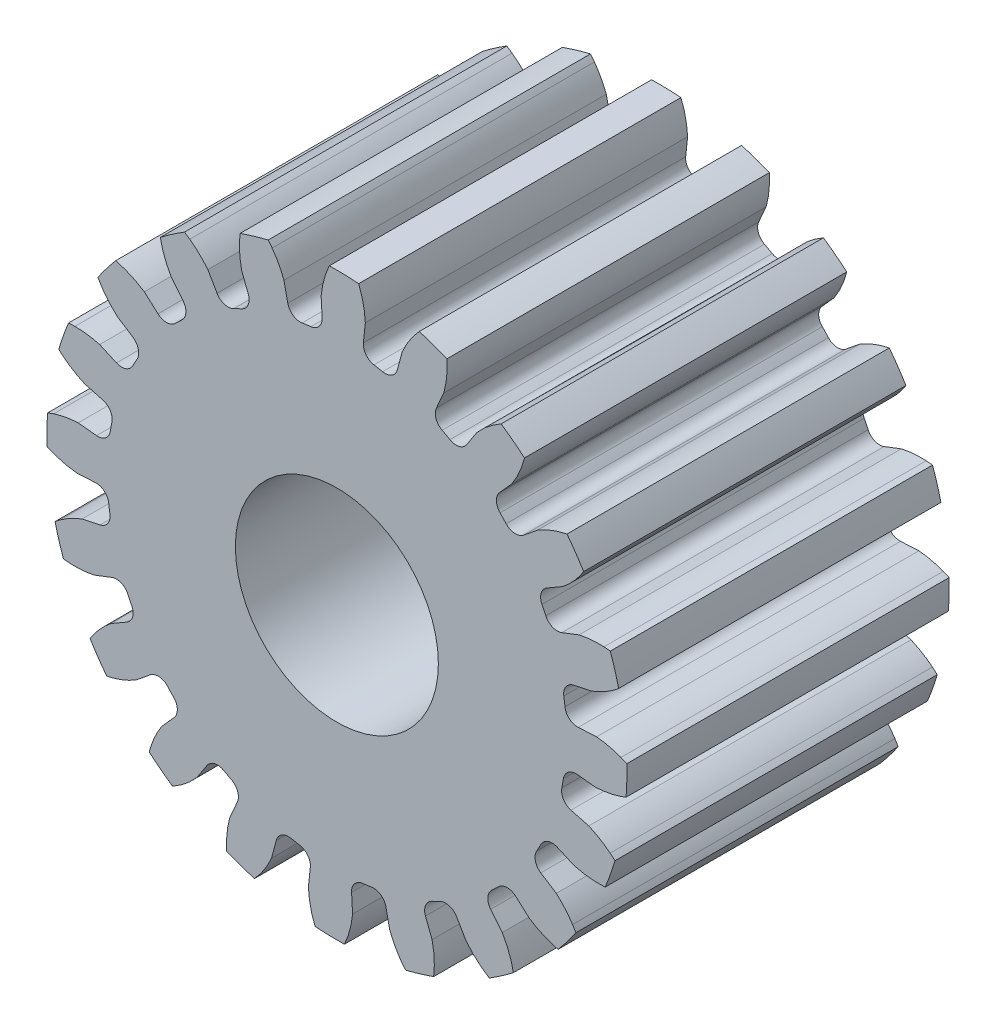
from build123d import *

# Parameters (mm, degrees)
SKETCH1_R           = 2
BOSS_EXTRUDE1_DEPTH = 6.35


with BuildPart() as part:
    # Sketch1 → Boss-Extrude1 (new body)
    with BuildSketch(Plane.XY):
        with BuildLine():
            Line((541.91920356, -238.032833552), (542.200542121, -237.804244593))
            ThreePointArc((542.200542121, -237.804244593), (542.376229885, -237.749043127), (542.54194547, -237.829365837))
            ThreePointArc((542.54194547, -237.829365837), (542.601476905, -237.893112552), (542.662226396, -237.955699571))
            ThreePointArc((542.662226396, -237.955699571), (542.734322782, -238.125156066), (542.670568959, -238.297924241))
            Line((542.670568959, -238.297924241), (542.428453434, -238.567710027))
            add(Edge.make_bspline(
                [(542.428453434, -238.567710027), (542.290505976, -238.776468723), (542.214843318, -239.011053945)],
                knots=[0, 0, 0, 1, 1, 1], degree=2))
            add(Edge.make_bspline(
                [(542.214843318, -239.011053945), (542.195602677, -239.07070781), (542.180389743, -239.132031774)],
                knots=[0, 0, 0, 1, 1, 1], degree=2))
            ThreePointArc((542.180389743, -239.132031774), (542.40591146, -239.313731208), (542.640348386, -239.483772548))
            add(Edge.make_bspline(
                [(542.640348386, -239.483772548), (542.695544755, -239.453024822), (542.748074148, -239.418827618)],
                knots=[0, 0, 0, 1, 1, 1], degree=2))
            add(Edge.make_bspline(
                [(542.748074148, -239.418827618), (542.954642815, -239.284349182), (543.119969158, -239.096527738)],
                knots=[0, 0, 0, 1, 1, 1], degree=2))
            Line((543.119969158, -239.096527738), (543.316900156, -238.792188323))
            ThreePointArc((543.316900156, -238.792188323), (543.466930958, -238.685398104), (543.649356927, -238.710580609))
            ThreePointArc((543.649356927, -238.710580609), (543.725673505, -238.752811113), (543.802790156, -238.793562279))
            ThreePointArc((543.802790156, -238.793562279), (543.923722831, -238.932445974), (543.916477644, -239.116459288))
            Line((543.916477644, -239.116459288), (543.769580489, -239.44785863))
            add(Edge.make_bspline(
                [(543.769580489, -239.44785863), (543.702894645, -239.689028057), (543.703426001, -239.935512908)],
                knots=[0, 0, 0, 1, 1, 1], degree=2))
            add(Edge.make_bspline(
                [(543.703426001, -239.935512908), (543.703561122, -239.99819279), (543.70804291, -240.0612164)],
                knots=[0, 0, 0, 1, 1, 1], degree=2))
            ThreePointArc((543.70804291, -240.0612164), (543.978675021, -240.164332788), (544.254183451, -240.253606718))
            add(Edge.make_bspline(
                [(544.254183451, -240.253606718), (544.297176747, -240.207307277), (544.336567653, -240.158551329)],
                knots=[0, 0, 0, 1, 1, 1], degree=2))
            add(Edge.make_bspline(
                [(544.336567653, -240.158551329), (544.491470007, -239.966821506), (544.590664684, -239.737104049)],
                knots=[0, 0, 0, 1, 1, 1], degree=2))
            Line((544.590664684, -239.737104049), (544.683911142, -239.38680504))
            ThreePointArc((544.683911142, -239.38680504), (544.793598922, -239.238879439), (544.97487815, -239.206456699))
            ThreePointArc((544.97487815, -239.206456699), (545.060509472, -239.223037176), (545.146444569, -239.237963482))
            ThreePointArc((545.146444569, -239.237963482), (545.304375799, -239.332679474), (545.354348458, -239.509925422))
            Line((545.354348458, -239.509925422), (545.31704899, -239.870498642))
            add(Edge.make_bspline(
                [(545.31704899, -239.870498642), (545.328152435, -240.120471456), (545.404825793, -240.354728282)],
                knots=[0, 0, 0, 1, 1, 1], degree=2))
            add(Edge.make_bspline(
                [(545.404825793, -240.354728282), (545.424323449, -240.414298638), (545.448061249, -240.472852704)],
                knots=[0, 0, 0, 1, 1, 1], degree=2))
            ThreePointArc((545.448061249, -240.472852704), (545.737312398, -240.487292295), (546.026923647, -240.487060061))
            add(Edge.make_bspline(
                [(546.026923647, -240.487060061), (546.053505388, -240.429741017), (546.075901948, -240.371198895)],
                knots=[0, 0, 0, 1, 1, 1], degree=2))
            add(Edge.make_bspline(
                [(546.075901948, -240.371198895), (546.163975068, -240.140985538), (546.187328214, -239.891858412)],
                knots=[0, 0, 0, 1, 1, 1], degree=2))
            Line((546.187328214, -239.891858412), (546.167762518, -239.529889517))
            ThreePointArc((546.167762518, -239.529889517), (546.226370272, -239.355308522), (546.388757885, -239.268454303))
            ThreePointArc((546.388757885, -239.268454303), (546.475321761, -239.257761739), (546.561663378, -239.245402095))
            ThreePointArc((546.561663378, -239.245402095), (546.741133754, -239.286678922), (546.843432588, -239.439807434))
            Line((546.843432588, -239.439807434), (546.919381938, -239.794259114))
            add(Edge.make_bspline(
                [(546.919381938, -239.794259114), (547.007187789, -240.028566235), (547.152497826, -240.227664345)],
                knots=[0, 0, 0, 1, 1, 1], degree=2))
            add(Edge.make_bspline(
                [(547.152497826, -240.227664345), (547.189449452, -240.278294013), (547.230119642, -240.326646856)],
                knots=[0, 0, 0, 1, 1, 1], degree=2))
            ThreePointArc((547.230119642, -240.326646856), (547.509675912, -240.250996202), (547.785040813, -240.161280537))
            add(Edge.make_bspline(
                [(547.785040813, -240.161280537), (547.792608992, -240.098552677), (547.795818876, -240.035954893)],
                knots=[0, 0, 0, 1, 1, 1], degree=2))
            add(Edge.make_bspline(
                [(547.795818876, -240.035954893), (547.808441551, -239.789792889), (547.753667197, -239.545642393)],
                knots=[0, 0, 0, 1, 1, 1], degree=2))
            Line((547.753667197, -239.545642393), (547.623204575, -239.207435649))
            ThreePointArc((547.623204575, -239.207435649), (547.624995366, -239.023288465), (547.752595734, -238.890504661))
            ThreePointArc((547.752595734, -238.890504661), (547.831618689, -238.85358572), (547.909915105, -238.815149973))
            ThreePointArc((547.909915105, -238.815149973), (548.093356817, -238.798947172), (548.237968102, -238.912968963))
            Line((548.237968102, -238.912968963), (548.41973182, -239.226602904))
            add(Edge.make_bspline(
                [(548.41973182, -239.226602904), (548.575645029, -239.422308717), (548.775367786, -239.566759001)],
                knots=[0, 0, 0, 1, 1, 1], degree=2))
            add(Edge.make_bspline(
                [(548.775367786, -239.566759001), (548.826156298, -239.603491997), (548.879777798, -239.636910503)],
                knots=[0, 0, 0, 1, 1, 1], degree=2))
            ThreePointArc((548.879777798, -239.636910503), (549.122274272, -239.478574817), (549.35643819, -239.308157716))
            add(Edge.make_bspline(
                [(549.35643819, -239.308157716), (549.344251982, -239.246161279), (549.327960984, -239.18563534)],
                knots=[0, 0, 0, 1, 1, 1], degree=2))
            add(Edge.make_bspline(
                [(549.327960984, -239.18563534), (549.263897619, -238.947620741), (549.13635746, -238.732346028)],
                knots=[0, 0, 0, 1, 1, 1], degree=2))
            Line((549.13635746, -238.732346028), (548.907768501, -238.451007467))
            ThreePointArc((548.907768501, -238.451007467), (548.852567036, -238.275319702), (548.932889745, -238.109604118))
            ThreePointArc((548.932889745, -238.109604118), (548.996636461, -238.050072683), (549.059223479, -237.989323192))
            ThreePointArc((549.059223479, -237.989323192), (549.228679974, -237.917226806), (549.40144815, -237.980980629))
            Line((549.40144815, -237.980980629), (549.671233935, -238.223096154))
            add(Edge.make_bspline(
                [(549.671233935, -238.223096154), (549.879992631, -238.361043612), (550.114577853, -238.43670627)],
                knots=[0, 0, 0, 1, 1, 1], degree=2))
            add(Edge.make_bspline(
                [(550.114577853, -238.43670627), (550.174231719, -238.455946911), (550.235555682, -238.471159844)],
                knots=[0, 0, 0, 1, 1, 1], degree=2))
            ThreePointArc((550.235555682, -238.471159844), (550.417255116, -238.245638128), (550.587296456, -238.011201202))
            add(Edge.make_bspline(
                [(550.587296456, -238.011201202), (550.55654873, -237.956004833), (550.522351527, -237.903475439)],
                knots=[0, 0, 0, 1, 1, 1], degree=2))
            add(Edge.make_bspline(
                [(550.522351527, -237.903475439), (550.38787309, -237.696906773), (550.200051646, -237.53158043)],
                knots=[0, 0, 0, 1, 1, 1], degree=2))
            Line((550.200051646, -237.53158043), (549.895712231, -237.334649432))
            ThreePointArc((549.895712231, -237.334649432), (549.788922012, -237.184618629), (549.814104517, -237.002192661))
            ThreePointArc((549.814104517, -237.002192661), (549.856335021, -236.925876083), (549.897086187, -236.848759432))
            ThreePointArc((549.897086187, -236.848759432), (550.035969882, -236.727826757), (550.219983197, -236.735071944))
            Line((550.219983197, -236.735071944), (550.551382538, -236.881969099))
            add(Edge.make_bspline(
                [(550.551382538, -236.881969099), (550.792551965, -236.948654943), (551.039036816, -236.948123587)],
                knots=[0, 0, 0, 1, 1, 1], degree=2))
            add(Edge.make_bspline(
                [(551.039036816, -236.948123587), (551.101716698, -236.947988466), (551.164740308, -236.943506678)],
                knots=[0, 0, 0, 1, 1, 1], degree=2))
            ThreePointArc((551.164740308, -236.943506678), (551.267856696, -236.672874567), (551.357130626, -236.397366137))
            add(Edge.make_bspline(
                [(551.357130626, -236.397366137), (551.310831185, -236.354372841), (551.262075237, -236.314981935)],
                knots=[0, 0, 0, 1, 1, 1], degree=2))
            add(Edge.make_bspline(
                [(551.262075237, -236.314981935), (551.070345415, -236.160079581), (550.840627957, -236.060884904)],
                knots=[0, 0, 0, 1, 1, 1], degree=2))
            Line((550.840627957, -236.060884904), (550.490328948, -235.967638446))
            ThreePointArc((550.490328948, -235.967638446), (550.342403347, -235.857950666), (550.309980608, -235.676671438))
            ThreePointArc((550.309980608, -235.676671438), (550.326561084, -235.591040116), (550.341487391, -235.505105019))
            ThreePointArc((550.341487391, -235.505105019), (550.436203382, -235.347173789), (550.61344933, -235.29720113))
            Line((550.61344933, -235.29720113), (550.97402255, -235.334500598))
            add(Edge.make_bspline(
                [(550.97402255, -235.334500598), (551.223995364, -235.323397153), (551.45825219, -235.246723795)],
                knots=[0, 0, 0, 1, 1, 1], degree=2))
            add(Edge.make_bspline(
                [(551.45825219, -235.246723795), (551.517822546, -235.227226139), (551.576376612, -235.203488339)],
                knots=[0, 0, 0, 1, 1, 1], degree=2))
            ThreePointArc((551.576376612, -235.203488339), (551.590816203, -234.91423719), (551.590583969, -234.624625941))
            add(Edge.make_bspline(
                [(551.590583969, -234.624625941), (551.533264925, -234.5980442), (551.474722803, -234.57564764)],
                knots=[0, 0, 0, 1, 1, 1], degree=2))
            add(Edge.make_bspline(
                [(551.474722803, -234.57564764), (551.244509447, -234.48757452), (550.995382321, -234.464221374)],
                knots=[0, 0, 0, 1, 1, 1], degree=2))
            Line((550.995382321, -234.464221374), (550.633413425, -234.48378707))
            ThreePointArc((550.633413425, -234.48378707), (550.458832431, -234.425179316), (550.371978211, -234.262791703))
            ThreePointArc((550.371978211, -234.262791703), (550.361285647, -234.176227827), (550.348926003, -234.08988621))
            ThreePointArc((550.348926003, -234.08988621), (550.39020283, -233.910415834), (550.543331342, -233.808117))
            Line((550.543331342, -233.808117), (550.897783023, -233.73216765))
            add(Edge.make_bspline(
                [(550.897783023, -233.73216765), (551.132090143, -233.644361799), (551.331188253, -233.499051762)],
                knots=[0, 0, 0, 1, 1, 1], degree=2))
            add(Edge.make_bspline(
                [(551.331188253, -233.499051762), (551.381817921, -233.462100136), (551.430170764, -233.421429946)],
                knots=[0, 0, 0, 1, 1, 1], degree=2))
            ThreePointArc((551.430170764, -233.421429946), (551.35452011, -233.141873676), (551.264804445, -232.866508775))
            add(Edge.make_bspline(
                [(551.264804445, -232.866508775), (551.202076585, -232.858940596), (551.139478801, -232.855730712)],
                knots=[0, 0, 0, 1, 1, 1], degree=2))
            add(Edge.make_bspline(
                [(551.139478801, -232.855730712), (550.893316797, -232.843108037), (550.649166301, -232.897882391)],
                knots=[0, 0, 0, 1, 1, 1], degree=2))
            Line((550.649166301, -232.897882391), (550.310959557, -233.028345013))
            ThreePointArc((550.310959557, -233.028345013), (550.126812373, -233.026554222), (549.994028569, -232.898953854))
            ThreePointArc((549.994028569, -232.898953854), (549.957109628, -232.819930899), (549.918673881, -232.741634483))
            ThreePointArc((549.918673881, -232.741634483), (549.90247108, -232.558192771), (550.016492871, -232.413581486))
            Line((550.016492871, -232.413581486), (550.330126812, -232.231817768))
            add(Edge.make_bspline(
                [(550.330126812, -232.231817768), (550.525832625, -232.075904559), (550.67028291, -231.876181802)],
                knots=[0, 0, 0, 1, 1, 1], degree=2))
            add(Edge.make_bspline(
                [(550.67028291, -231.876181802), (550.707015905, -231.82539329), (550.740434411, -231.77177179)],
                knots=[0, 0, 0, 1, 1, 1], degree=2))
            ThreePointArc((550.740434411, -231.77177179), (550.582098726, -231.529275316), (550.411681624, -231.295111398))
            add(Edge.make_bspline(
                [(550.411681624, -231.295111398), (550.349685188, -231.307297606), (550.289159248, -231.323588604)],
                knots=[0, 0, 0, 1, 1, 1], degree=2))
            add(Edge.make_bspline(
                [(550.289159248, -231.323588604), (550.051144649, -231.387651969), (549.835869936, -231.515192128)],
                knots=[0, 0, 0, 1, 1, 1], degree=2))
            Line((549.835869936, -231.515192128), (549.554531376, -231.743781087))
            ThreePointArc((549.554531376, -231.743781087), (549.378843611, -231.798982552), (549.213128026, -231.718659843))
            ThreePointArc((549.213128026, -231.718659843), (549.153596591, -231.654913127), (549.0928471, -231.592326109))
            ThreePointArc((549.0928471, -231.592326109), (549.020750714, -231.422869614), (549.084504537, -231.250101438))
            Line((549.084504537, -231.250101438), (549.326620062, -230.980315653))
            add(Edge.make_bspline(
                [(549.326620062, -230.980315653), (549.46456752, -230.771556957), (549.540230178, -230.536971735)],
                knots=[0, 0, 0, 1, 1, 1], degree=2))
            add(Edge.make_bspline(
                [(549.540230178, -230.536971735), (549.559470819, -230.477317869), (549.574683753, -230.415993906)],
                knots=[0, 0, 0, 1, 1, 1], degree=2))
            ThreePointArc((549.574683753, -230.415993906), (549.349162036, -230.234294472), (549.114725111, -230.064253132))
            add(Edge.make_bspline(
                [(549.114725111, -230.064253132), (549.059528741, -230.095000858), (549.006999348, -230.129198061)],
                knots=[0, 0, 0, 1, 1, 1], degree=2))
            add(Edge.make_bspline(
                [(549.006999348, -230.129198061), (548.800430681, -230.263676498), (548.635104338, -230.451497942)],
                knots=[0, 0, 0, 1, 1, 1], degree=2))
            Line((548.635104338, -230.451497942), (548.43817334, -230.755837357))
            ThreePointArc((548.43817334, -230.755837357), (548.288142538, -230.862627576), (548.105716569, -230.837445071))
            ThreePointArc((548.105716569, -230.837445071), (548.029399991, -230.795214567), (547.95228334, -230.754463401))
            ThreePointArc((547.95228334, -230.754463401), (547.831350666, -230.615579705), (547.838595852, -230.431566391))
            Line((547.838595852, -230.431566391), (547.985493007, -230.10016705))
            add(Edge.make_bspline(
                [(547.985493007, -230.10016705), (548.052178851, -229.858997623), (548.051647495, -229.612512772)],
                knots=[0, 0, 0, 1, 1, 1], degree=2))
            add(Edge.make_bspline(
                [(548.051647495, -229.612512772), (548.051512374, -229.549832889), (548.047030586, -229.48680928)],
                knots=[0, 0, 0, 1, 1, 1], degree=2))
            ThreePointArc((548.047030586, -229.48680928), (547.776398475, -229.383692892), (547.500890046, -229.294418962))
            add(Edge.make_bspline(
                [(547.500890046, -229.294418962), (547.457896749, -229.340718402), (547.418505844, -229.389474351)],
                knots=[0, 0, 0, 1, 1, 1], degree=2))
            add(Edge.make_bspline(
                [(547.418505844, -229.389474351), (547.263603489, -229.581204173), (547.164408812, -229.810921631)],
                knots=[0, 0, 0, 1, 1, 1], degree=2))
            Line((547.164408812, -229.810921631), (547.071162354, -230.16122064))
            ThreePointArc((547.071162354, -230.16122064), (546.961474574, -230.309146241), (546.780195346, -230.34156898))
            ThreePointArc((546.780195346, -230.34156898), (546.694564024, -230.324988504), (546.608628927, -230.310062197))
            ThreePointArc((546.608628927, -230.310062197), (546.450697697, -230.215346205), (546.400725038, -230.038100258))
            Line((546.400725038, -230.038100258), (546.438024506, -229.677527038))
            add(Edge.make_bspline(
                [(546.438024506, -229.677527038), (546.426921061, -229.427554224), (546.350247704, -229.193297398)],
                knots=[0, 0, 0, 1, 1, 1], degree=2))
            add(Edge.make_bspline(
                [(546.350247704, -229.193297398), (546.330750047, -229.133727042), (546.307012247, -229.075172976)],
                knots=[0, 0, 0, 1, 1, 1], degree=2))
            ThreePointArc((546.307012247, -229.075172976), (546.017761098, -229.060733385), (545.728149849, -229.060965618))
            add(Edge.make_bspline(
                [(545.728149849, -229.060965618), (545.701568108, -229.118284663), (545.679171548, -229.176826785)],
                knots=[0, 0, 0, 1, 1, 1], degree=2))
            add(Edge.make_bspline(
                [(545.679171548, -229.176826785), (545.591098428, -229.407040141), (545.567745282, -229.656167267)],
                knots=[0, 0, 0, 1, 1, 1], degree=2))
            Line((545.567745282, -229.656167267), (545.587310978, -230.018136163))
            ThreePointArc((545.587310978, -230.018136163), (545.528703224, -230.192717157), (545.366315611, -230.279571377))
            ThreePointArc((545.366315611, -230.279571377), (545.279751735, -230.290263941), (545.193410119, -230.302623585))
            ThreePointArc((545.193410119, -230.302623585), (545.013939742, -230.261346758), (544.911640909, -230.108218246))
            Line((544.911640909, -230.108218246), (544.835691558, -229.753766565))
            add(Edge.make_bspline(
                [(544.835691558, -229.753766565), (544.747885707, -229.519459445), (544.60257567, -229.320361335)],
                knots=[0, 0, 0, 1, 1, 1], degree=2))
            add(Edge.make_bspline(
                [(544.60257567, -229.320361335), (544.565624044, -229.269731667), (544.524953854, -229.221378824)],
                knots=[0, 0, 0, 1, 1, 1], degree=2))
            ThreePointArc((544.524953854, -229.221378824), (544.245397584, -229.297029478), (543.970032683, -229.386745142))
            add(Edge.make_bspline(
                [(543.970032683, -229.386745142), (543.962464504, -229.449473003), (543.95925462, -229.512070787)],
                knots=[0, 0, 0, 1, 1, 1], degree=2))
            add(Edge.make_bspline(
                [(543.95925462, -229.512070787), (543.946631945, -229.758232791), (544.001406299, -230.002383286)],
                knots=[0, 0, 0, 1, 1, 1], degree=2))
            Line((544.001406299, -230.002383286), (544.131868922, -230.34059003))
            ThreePointArc((544.131868922, -230.34059003), (544.13007813, -230.524737215), (544.002477762, -230.657521019))
            ThreePointArc((544.002477762, -230.657521019), (543.923454808, -230.69443996), (543.845158391, -230.732875707))
            ThreePointArc((543.845158391, -230.732875707), (543.661716679, -230.749078508), (543.517105394, -230.635056717))
            Line((543.517105394, -230.635056717), (543.335341677, -230.321422776))
            add(Edge.make_bspline(
                [(543.335341677, -230.321422776), (543.179428467, -230.125716963), (542.979705711, -229.981266678)],
                knots=[0, 0, 0, 1, 1, 1], degree=2))
            add(Edge.make_bspline(
                [(542.979705711, -229.981266678), (542.928917198, -229.944533683), (542.875295698, -229.911115177)],
                knots=[0, 0, 0, 1, 1, 1], degree=2))
            ThreePointArc((542.875295698, -229.911115177), (542.632799224, -230.069450862), (542.398635306, -230.239867964))
            add(Edge.make_bspline(
                [(542.398635306, -230.239867964), (542.410821514, -230.3018644), (542.427112512, -230.36239034)],
                knots=[0, 0, 0, 1, 1, 1], degree=2))
            add(Edge.make_bspline(
                [(542.427112512, -230.36239034), (542.491175878, -230.600404939), (542.618716036, -230.815679652)],
                knots=[0, 0, 0, 1, 1, 1], degree=2))
            Line((542.618716036, -230.815679652), (542.847304995, -231.097018212))
            ThreePointArc((542.847304995, -231.097018212), (542.902506461, -231.272705977), (542.822183751, -231.438421561))
            ThreePointArc((542.822183751, -231.438421561), (542.758437035, -231.497952997), (542.695850017, -231.558702488))
            ThreePointArc((542.695850017, -231.558702488), (542.526393522, -231.630798873), (542.353625346, -231.567045051))
            Line((542.353625346, -231.567045051), (542.083839561, -231.324929526))
            add(Edge.make_bspline(
                [(542.083839561, -231.324929526), (541.875080865, -231.186982068), (541.640495643, -231.111319409)],
                knots=[0, 0, 0, 1, 1, 1], degree=2))
            add(Edge.make_bspline(
                [(541.640495643, -231.111319409), (541.580841778, -231.092078768), (541.519517814, -231.076865835)],
                knots=[0, 0, 0, 1, 1, 1], degree=2))
            ThreePointArc((541.519517814, -231.076865835), (541.33781838, -231.302387552), (541.16777704, -231.536824477))
            add(Edge.make_bspline(
                [(541.16777704, -231.536824477), (541.198524766, -231.592020847), (541.232721969, -231.64455024)],
                knots=[0, 0, 0, 1, 1, 1], degree=2))
            add(Edge.make_bspline(
                [(541.232721969, -231.64455024), (541.367200406, -231.851118907), (541.55502185, -232.01644525)],
                knots=[0, 0, 0, 1, 1, 1], degree=2))
            Line((541.55502185, -232.01644525), (541.859361265, -232.213376248))
            ThreePointArc((541.859361265, -232.213376248), (541.966151484, -232.36340705), (541.940968979, -232.545833019))
            ThreePointArc((541.940968979, -232.545833019), (541.898738475, -232.622149597), (541.857987309, -232.699266248))
            ThreePointArc((541.857987309, -232.699266248), (541.719103614, -232.820198922), (541.535090299, -232.812953736))
            Line((541.535090299, -232.812953736), (541.203690958, -232.666056581))
            add(Edge.make_bspline(
                [(541.203690958, -232.666056581), (540.962521531, -232.599370737), (540.71603668, -232.599902093)],
                knots=[0, 0, 0, 1, 1, 1], degree=2))
            add(Edge.make_bspline(
                [(540.71603668, -232.599902093), (540.653356798, -232.600037214), (540.590333188, -232.604519002)],
                knots=[0, 0, 0, 1, 1, 1], degree=2))
            ThreePointArc((540.590333188, -232.604519002), (540.4872168, -232.875151113), (540.39794287, -233.150659542))
            add(Edge.make_bspline(
                [(540.39794287, -233.150659542), (540.444242311, -233.193652839), (540.492998259, -233.233043744)],
                knots=[0, 0, 0, 1, 1, 1], degree=2))
            add(Edge.make_bspline(
                [(540.492998259, -233.233043744), (540.684728082, -233.387946099), (540.914445539, -233.487140776)],
                knots=[0, 0, 0, 1, 1, 1], degree=2))
            Line((540.914445539, -233.487140776), (541.264744548, -233.580387233))
            ThreePointArc((541.264744548, -233.580387233), (541.412670149, -233.690075014), (541.445092888, -233.871354242))
            ThreePointArc((541.445092888, -233.871354242), (541.428512412, -233.956985564), (541.413586106, -234.042920661))
            ThreePointArc((541.413586106, -234.042920661), (541.318870114, -234.200851891), (541.141624166, -234.25082455))
            Line((541.141624166, -234.25082455), (540.781050946, -234.213525082))
            add(Edge.make_bspline(
                [(540.781050946, -234.213525082), (540.531078132, -234.224628527), (540.296821306, -234.301301884)],
                knots=[0, 0, 0, 1, 1, 1], degree=2))
            add(Edge.make_bspline(
                [(540.296821306, -234.301301884), (540.23725095, -234.320799541), (540.178696884, -234.344537341)],
                knots=[0, 0, 0, 1, 1, 1], degree=2))
            ThreePointArc((540.178696884, -234.344537341), (540.164257293, -234.63378849), (540.164489527, -234.923399739))
            add(Edge.make_bspline(
                [(540.164489527, -234.923399739), (540.221808571, -234.94998148), (540.280350693, -234.97237804)],
                knots=[0, 0, 0, 1, 1, 1], degree=2))
            add(Edge.make_bspline(
                [(540.280350693, -234.97237804), (540.51056405, -235.06045116), (540.759691176, -235.083804306)],
                knots=[0, 0, 0, 1, 1, 1], degree=2))
            Line((540.759691176, -235.083804306), (541.121660071, -235.06423861))
            ThreePointArc((541.121660071, -235.06423861), (541.296241066, -235.122846364), (541.383095285, -235.285233977))
            ThreePointArc((541.383095285, -235.285233977), (541.393787849, -235.371797853), (541.406147493, -235.458139469))
            ThreePointArc((541.406147493, -235.458139469), (541.364870666, -235.637609846), (541.211742154, -235.739908679))
            Line((541.211742154, -235.739908679), (540.857290473, -235.81585803))
            add(Edge.make_bspline(
                [(540.857290473, -235.81585803), (540.622983353, -235.903663881), (540.423885243, -236.048973918)],
                knots=[0, 0, 0, 1, 1, 1], degree=2))
            add(Edge.make_bspline(
                [(540.423885243, -236.048973918), (540.373255575, -236.085925544), (540.324902732, -236.126595734)],
                knots=[0, 0, 0, 1, 1, 1], degree=2))
            ThreePointArc((540.324902732, -236.126595734), (540.400553386, -236.406152004), (540.490269051, -236.681516905))
            add(Edge.make_bspline(
                [(540.490269051, -236.681516905), (540.552996911, -236.689085084), (540.615594695, -236.692294968)],
                knots=[0, 0, 0, 1, 1, 1], degree=2))
            add(Edge.make_bspline(
                [(540.615594695, -236.692294968), (540.861756699, -236.704917643), (541.105907195, -236.650143289)],
                knots=[0, 0, 0, 1, 1, 1], degree=2))
            Line((541.105907195, -236.650143289), (541.444113939, -236.519680666))
            ThreePointArc((541.444113939, -236.519680666), (541.628261123, -236.521471458), (541.761044927, -236.649071826))
            ThreePointArc((541.761044927, -236.649071826), (541.797963868, -236.72809478), (541.836399615, -236.806391197))
            ThreePointArc((541.836399615, -236.806391197), (541.852602416, -236.989832909), (541.738580625, -237.134444194))
            Line((541.738580625, -237.134444194), (541.424946684, -237.316207911))
            add(Edge.make_bspline(
                [(541.424946684, -237.316207911), (541.229240871, -237.472121121), (541.084790587, -237.671843877)],
                knots=[0, 0, 0, 1, 1, 1], degree=2))
            add(Edge.make_bspline(
                [(541.084790587, -237.671843877), (541.048057591, -237.72263239), (541.014639085, -237.77625389)],
                knots=[0, 0, 0, 1, 1, 1], degree=2))
            ThreePointArc((541.014639085, -237.77625389), (541.172974771, -238.018750364), (541.343391872, -238.252914282))
            add(Edge.make_bspline(
                [(541.343391872, -238.252914282), (541.405388309, -238.240728073), (541.465914248, -238.224437076)],
                knots=[0, 0, 0, 1, 1, 1], degree=2))
            add(Edge.make_bspline(
                [(541.465914248, -238.224437076), (541.703928847, -238.16037371), (541.91920356, -238.032833552)],
                knots=[0, 0, 0, 1, 1, 1], degree=2))
        make_face()
        with Locations((545.877536748, -234.77401284)):
            Circle(SKETCH1_R, mode=Mode.SUBTRACT)
    extrude(amount=BOSS_EXTRUDE1_DEPTH)


solid = part.part
